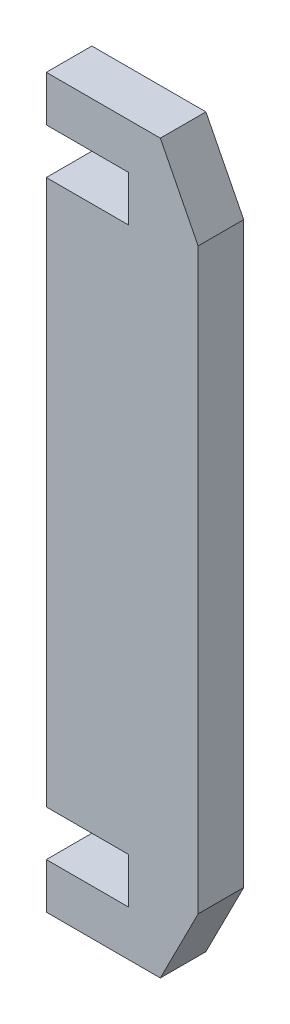
from build123d import *

# Parameters (mm, degrees)
BASE_EXTRUDE_DEPTH = 3


with BuildPart() as part:
    # Sketch1 → Base-Extrude (new body)
    with BuildSketch(Plane.XY):
        Polygon((882.909650659, -114.517142196), (882.909650659, -76.423420009), (880.419804328, -71.520281102), (872.909650659, -71.520281102), (872.909650659, -74.520281102), (878.318576624, -74.520281102), (878.318576624, -77.520281102), (872.909650659, -77.520281102), (872.909650659, -103.499568009), (872.909650659, -113.420281102), (878.318576624, -113.420281102), (878.318576624, -116.420281102), (872.909650659, -116.420281102), (872.909650659, -119.420281102), (880.419804328, -119.420281102), align=None)
    extrude(amount=BASE_EXTRUDE_DEPTH)


solid = part.part
